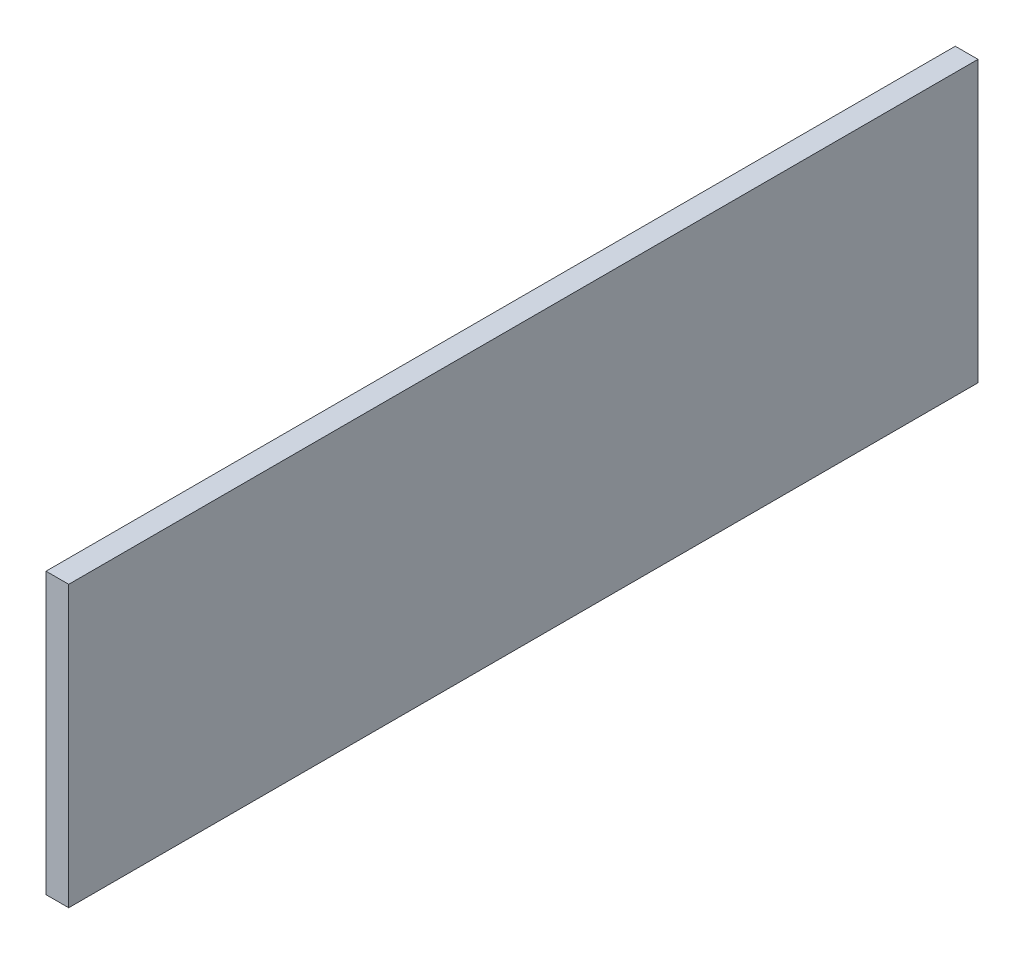
from build123d import *

# Parameters (mm, degrees)
SKETCH1_W           = 9.525
SKETCH1_H           = 117.458333333
BOSS_EXTRUDE1_DEPTH = 381.25


with BuildPart() as part:
    # Sketch1 → Boss-Extrude1 (new body)
    with BuildSketch(Plane.XY):
        with Locations((-81.745833333, 431.745833334)):
            Rectangle(SKETCH1_W, SKETCH1_H)
    extrude(amount=BOSS_EXTRUDE1_DEPTH)


solid = part.part
